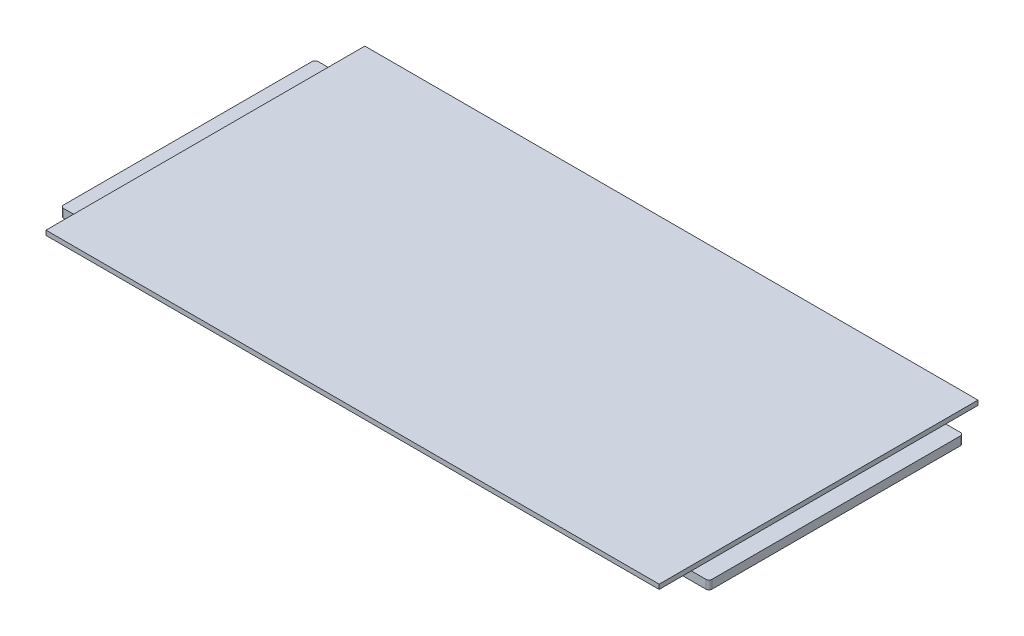
from build123d import *

# Parameters (mm, degrees)
SKETCH1_W                    = 1343.025
SKETCH1_H                    = 527.05
BOSS_EXTRUDE1_DEPTH          = 17.78
FILLET1_R                    = 6.35
F_1_8_0_125_DIAMETER_HOLE1_D = 3.175
SKETCH2_W                    = 1270
SKETCH2_H                    = 660.4
BOSS_EXTRUDE2_DEPTH          = 9.525


with BuildPart() as part:
    # Sketch1 → Boss-Extrude1 (new body)
    with BuildSketch(Plane(origin=(0, 0, 0), x_dir=(1, 0, 0), z_dir=(0, 1, 0))):
        Rectangle(SKETCH1_W, SKETCH1_H)
    extrude(amount=BOSS_EXTRUDE1_DEPTH)

    # Fillet1
    fillet1_edges = [part.edges().sort_by_distance(p)[0] for p in [
        (671.5125, 8.89, 263.525),
        (-671.5125, 8.89, 263.525),
        (-671.5125, 8.89, -263.525),
        (671.5125, 8.89, -263.525),
    ]]
    fillet(fillet1_edges, radius=FILLET1_R)

    # 1/8 (0.125) Diameter Hole1 (through all)
    with Locations(Plane(origin=(0, 17.78, 0), x_dir=(1, 0, 0), z_dir=(0, 1, 0))):
        with Locations((0, 0), (457.2, 152.4), (-457.2, -152.4), (-457.2, 152.4), (457.2, -152.4)):
            Hole(F_1_8_0_125_DIAMETER_HOLE1_D / 2)

    # Sketch2 → Boss-Extrude2 (add)
    with BuildSketch(Plane(origin=(0, 17.78, 0), x_dir=(1, 0, 0), z_dir=(0, 1, 0))):
        Rectangle(SKETCH2_W, SKETCH2_H)
    extrude(amount=BOSS_EXTRUDE2_DEPTH)


solid = part.part
